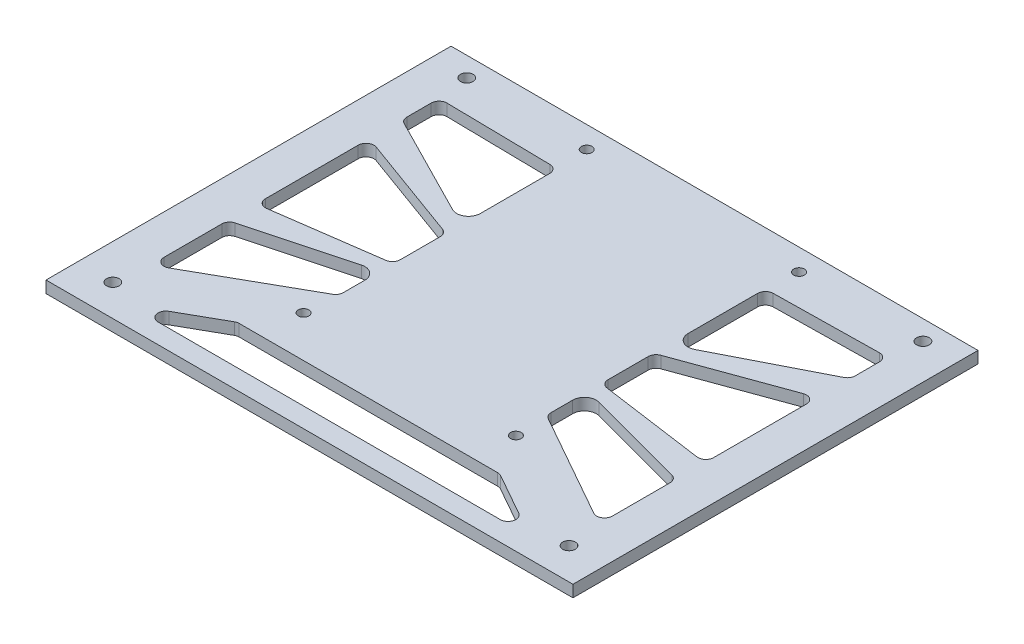
from build123d import *

# Parameters (mm, degrees)
SKETCH_1_W          = 134
SKETCH_1_H          = 103
EXTRUDE_1_DEPTH     = 3
SKETCH_5_R          = 1.35
CUT_EXTRUDE_3_DEPTH = 85.559150895
SKETCH_6_R          = 1.6
CUT_EXTRUDE_4_DEPTH = 85.559150895
CUT_EXTRUDE_5_DEPTH = 85.559150895
FILLET_1_R          = 3
CUT_EXTRUDE_6_DEPTH = 85.559150895
FILLET_2_R          = 2


with BuildPart() as part:
    # 草图1 → 凸台-拉伸1 (new body)
    with BuildSketch(Plane(origin=(0, 0, 0), x_dir=(1, 0, 0), z_dir=(0, 1, 0))):
        Rectangle(SKETCH_1_W, SKETCH_1_H)
    extrude(amount=EXTRUDE_1_DEPTH)

    # 草图5 → 切除-拉伸3 (cut, through all)
    with BuildSketch(Plane(origin=(0, 3, 0), x_dir=(1, 0, 0), z_dir=(0, 1, 0))):
        with Locations(Location((27, -26, 0), (0, 0, 270))):
            Circle(SKETCH_5_R)
        with Locations(Location((-27, -26, 0), (0, 0, 270))):
            Circle(SKETCH_5_R)
        with Locations(Location((27, 46, 0), (0, 0, 270))):
            Circle(SKETCH_5_R)
        with Locations(Location((-27, 46, 0), (0, 0, 270))):
            Circle(SKETCH_5_R)
    extrude(amount=-CUT_EXTRUDE_3_DEPTH, mode=Mode.SUBTRACT)

    # 草图6 → 切除-拉伸4 (cut, through all)
    with BuildSketch(Plane(origin=(0, 3, 0), x_dir=(1, 0, 0), z_dir=(0, 1, 0))):
        with Locations(Location((58, 46.5, 0), (0, 0, 270))):
            Circle(SKETCH_6_R)
        with Locations(Location((58, -43.5, 0), (0, 0, 270))):
            Circle(SKETCH_6_R)
        with Locations(Location((-58, 46.5, 0), (0, 0, 90))):
            Circle(SKETCH_6_R)
        with Locations(Location((-58, -43.5, 0), (0, 0, 90))):
            Circle(SKETCH_6_R)
    extrude(amount=-CUT_EXTRUDE_4_DEPTH, mode=Mode.SUBTRACT)

    # 草图7 → 切除-拉伸5 (cut, through all)
    with BuildSketch(Plane.XZ):
        Polygon((-26.4206829, 17.634605341), (-57, 34.897123059), (-57, 15.273103969), (-26.4206829, 7.079400646), align=None)
        Polygon((-26.4206829, 3.713184828), (-57, 8.010827578), (-57, -20.746303353), (-26.4206829, -9.616342144), align=None)
        Polygon((-26.4206829, -37.989615661), (-26.4206829, -13.46201033), (-57, -29.042950621), (-57, -38.482830453), align=None)
        Polygon((57, -29.042950621), (26.4206829, -13.46201033), (26.4206829, -37.989615661), (57, -38.482830453), align=None)
        Polygon((26.4206829, 3.713184828), (26.4206829, -9.616342144), (57, -20.746303353), (57, 8.010827578), align=None)
        Polygon((26.4206829, 17.634605341), (26.4206829, 7.079400646), (57, 15.273103969), (57, 34.897123059), align=None)
    extrude(amount=-CUT_EXTRUDE_5_DEPTH, mode=Mode.SUBTRACT)

    # 圆角1
    fillet_1_edges = [part.edges().sort_by_distance(p)[0] for p in [
        (-26.4206829, 1.5, 7.079400646),
        (-26.4206829, 1.5, -13.46201033),
        (26.4206829, 1.5, -13.46201033),
        (26.4206829, 1.5, 7.079400646),
    ]]
    fillet(fillet_1_edges, radius=FILLET_1_R)

    # 草图9 → 切除-拉伸6 (cut, through all)
    with BuildSketch(Plane.XZ):
        Polygon((51.109101135, 46.5), (33.394815421, 36.5), (-33.394815421, 36.5), (-51.109101135, 46.5), align=None)
    extrude(amount=-CUT_EXTRUDE_6_DEPTH, mode=Mode.SUBTRACT)

    # 圆角2
    fillet_2_edges = [part.edges().sort_by_distance(p)[0] for p in [
        (-57, 1.5, 15.273103969),
        (-57, 1.5, 34.897123059),
        (-26.4206829, 1.5, 17.634605341),
        (-51.109101135, 1.5, 46.5),
        (51.109101135, 1.5, 46.5),
        (33.394815421, 1.5, 36.5),
        (-33.394815421, 1.5, 36.5),
        (-26.4206829, 1.5, -37.989615661),
        (-57, 1.5, -38.482830453),
        (-57, 1.5, -29.042950621),
        (-26.4206829, 1.5, -9.616342144),
        (-57, 1.5, -20.746303353),
        (-57, 1.5, 8.010827578),
        (-26.4206829, 1.5, 3.713184828),
        (26.4206829, 1.5, 3.713184828),
        (57, 1.5, 8.010827578),
        (57, 1.5, -20.746303353),
        (26.4206829, 1.5, -9.616342144),
        (57, 1.5, -29.042950621),
        (57, 1.5, -38.482830453),
        (26.4206829, 1.5, -37.989615661),
        (26.4206829, 1.5, 17.634605341),
        (57, 1.5, 34.897123059),
        (57, 1.5, 15.273103969),
    ]]
    fillet(fillet_2_edges, radius=FILLET_2_R)


solid = part.part
